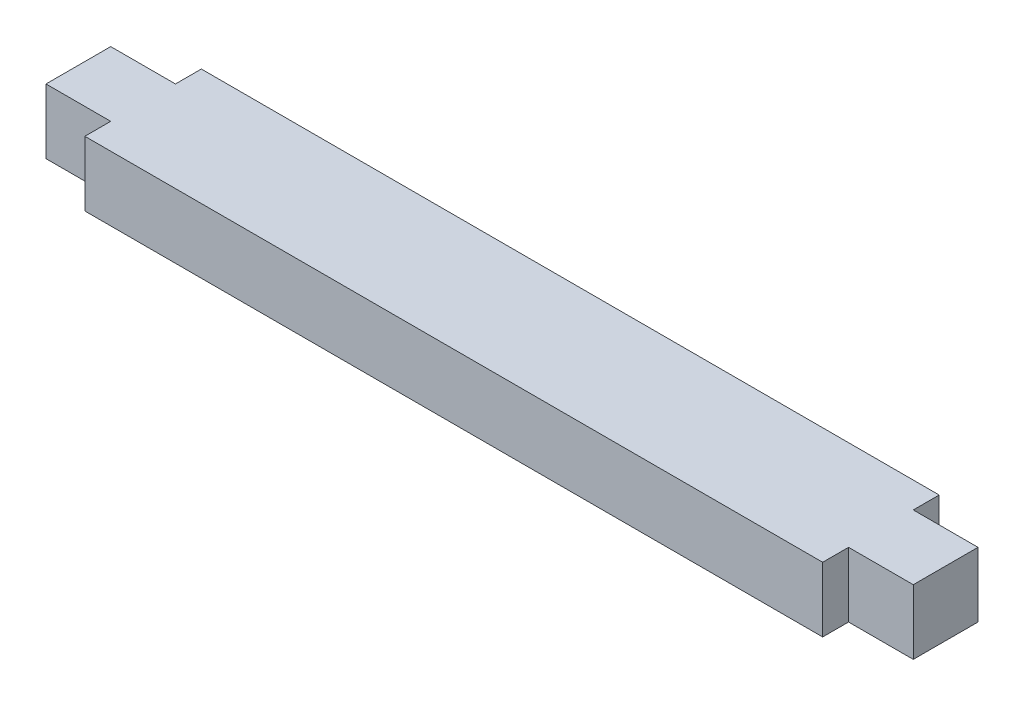
from build123d import *

# Parameters (mm, degrees)
BOSS_EXTRUDE1_DEPTH = 6.35


with BuildPart() as part:
    # Sketch1 → Boss-Extrude1 (new body)
    with BuildSketch(Plane(origin=(0, 0, 0), x_dir=(1, 0, 0), z_dir=(0, 1, 0))):
        Polygon((-36.195, 5.715), (36.195, 5.715), (36.195, 3.175), (42.545, 3.175), (42.545, -3.175), (36.195, -3.175), (36.195, -5.715), (-36.195, -5.715), (-36.195, -3.175), (-42.545, -3.175), (-42.545, 3.175), (-36.195, 3.175), align=None)
    extrude(amount=BOSS_EXTRUDE1_DEPTH)


solid = part.part
